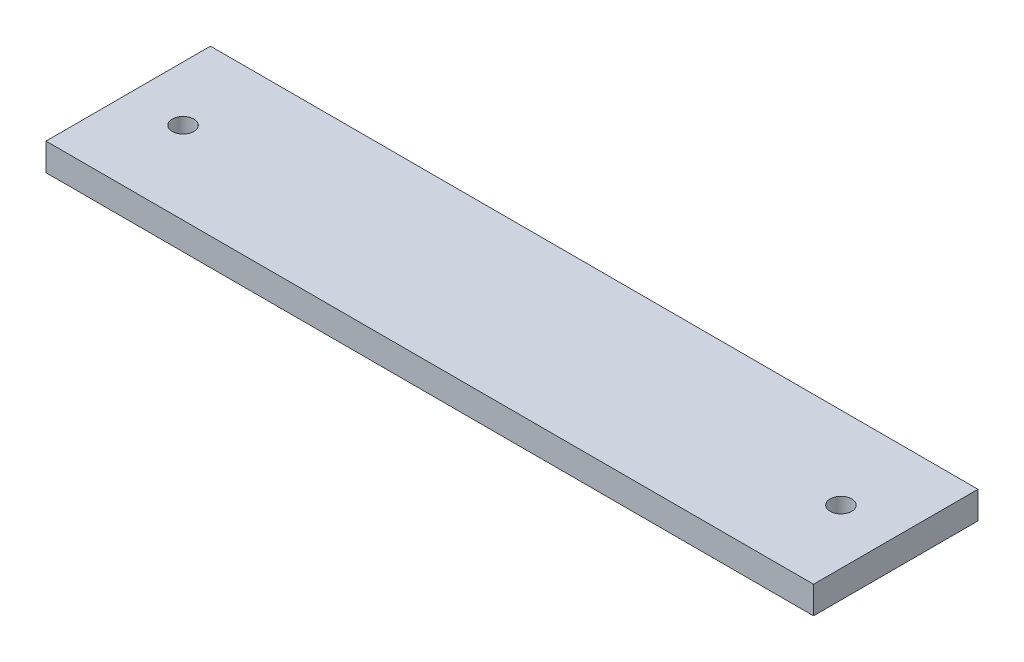
from build123d import *

# Parameters (mm, degrees)
SKETCH1_W           = 177.8
SKETCH1_H           = 38.1
SKETCH1_R           = 2.5
BOSS_EXTRUDE1_DEPTH = 6.35


with BuildPart() as part:
    # Sketch1 → Boss-Extrude1 (new body)
    with BuildSketch(Plane(origin=(0, 0, 0), x_dir=(1, 0, 0), z_dir=(0, 1, 0))):
        with Locations((88.9, 19.05)):
            Rectangle(SKETCH1_W, SKETCH1_H)
        with Locations(Location((12.7, 19.05, 0), (0, 0, 270))):
            Circle(SKETCH1_R, mode=Mode.SUBTRACT)
        with Locations(Location((165.1, 19.05, 0), (0, 0, 270))):
            Circle(SKETCH1_R, mode=Mode.SUBTRACT)
    extrude(amount=BOSS_EXTRUDE1_DEPTH)


solid = part.part
